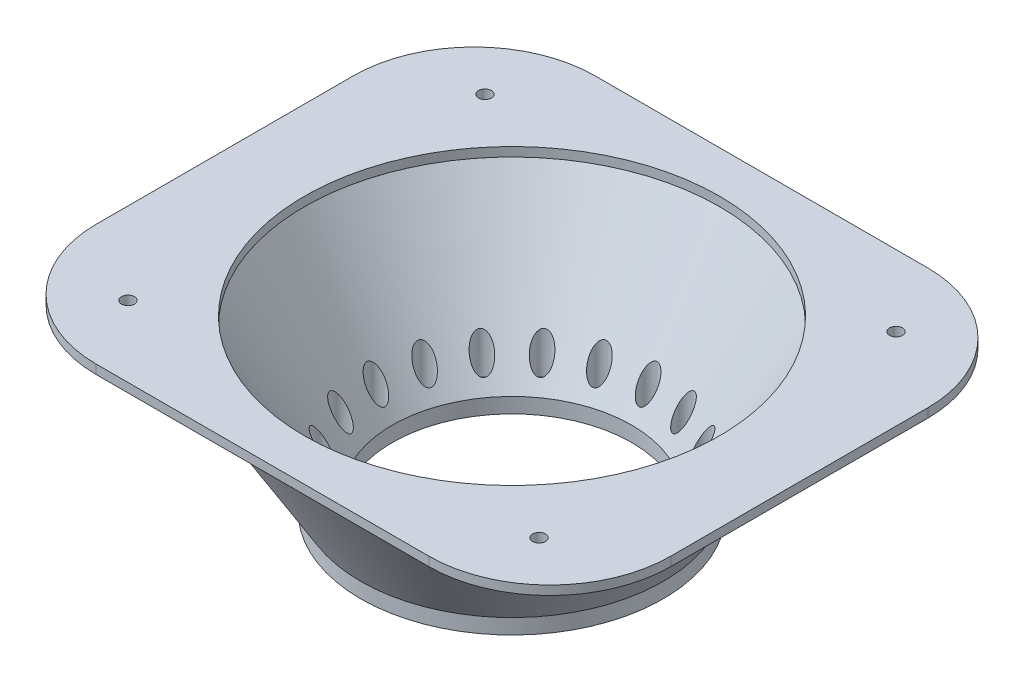
from build123d import *

# Parameters (mm, degrees)
SKETCH4_R           = 50
SKETCH4_R_2         = 39.565
SKETCH4_R_3         = 1.75
BOSS_EXTRUDE3_DEPTH = 5
SKETCH7_W           = 190
SKETCH7_H           = 165
SKETCH7_R           = 68.628897091
SKETCH7_R_2         = 2.15
BOSS_EXTRUDE4_DEPTH = 3
FILLET1_R           = 40
CUT_EXTRUDE1_START  = -5
SKETCH8_R           = 3
CUT_EXTRUDE1_DEPTH  = 133.721639549


with BuildPart() as part:
    # Sketch4 → Boss-Extrude3 (new body)
    with BuildSketch(Plane(origin=(0, 0, 0), x_dir=(1, 0, 0), z_dir=(0, 1, 0))):
        with Locations(Location((0, 0, 0), (0, 0, 270))):
            Circle(SKETCH4_R)
        with Locations(Location((0, 0, 0), (0, 0, 270))):
            Circle(SKETCH4_R_2, mode=Mode.SUBTRACT)
        with Locations(Location((0, -45, 0), (0, 0, 270))):
            Circle(SKETCH4_R_3, mode=Mode.SUBTRACT)
        with Locations(Location((-13.905764747, -42.797543233, 0), (0, 0, 270))):
            Circle(SKETCH4_R_3, mode=Mode.SUBTRACT)
        with Locations(Location((-26.450336353, -36.405764747, 0), (0, 0, 270))):
            Circle(SKETCH4_R_3, mode=Mode.SUBTRACT)
        with Locations(Location((-36.405764747, -26.450336353, 0), (0, 0, 270))):
            Circle(SKETCH4_R_3, mode=Mode.SUBTRACT)
        with Locations(Location((-42.797543233, -13.905764747, 0), (0, 0, 270))):
            Circle(SKETCH4_R_3, mode=Mode.SUBTRACT)
        with Locations(Location((-45, 0, 0), (0, 0, 270))):
            Circle(SKETCH4_R_3, mode=Mode.SUBTRACT)
        with Locations(Location((-42.797543233, 13.905764747, 0), (0, 0, 270))):
            Circle(SKETCH4_R_3, mode=Mode.SUBTRACT)
        with Locations(Location((-36.405764747, 26.450336353, 0), (0, 0, 270))):
            Circle(SKETCH4_R_3, mode=Mode.SUBTRACT)
        with Locations(Location((-26.450336353, 36.405764747, 0), (0, 0, 270))):
            Circle(SKETCH4_R_3, mode=Mode.SUBTRACT)
        with Locations(Location((-13.905764747, 42.797543233, 0), (0, 0, 270))):
            Circle(SKETCH4_R_3, mode=Mode.SUBTRACT)
        with Locations(Location((0, 45, 0), (0, 0, 270))):
            Circle(SKETCH4_R_3, mode=Mode.SUBTRACT)
        with Locations(Location((13.905764747, 42.797543233, 0), (0, 0, 270))):
            Circle(SKETCH4_R_3, mode=Mode.SUBTRACT)
        with Locations(Location((26.450336353, 36.405764747, 0), (0, 0, 270))):
            Circle(SKETCH4_R_3, mode=Mode.SUBTRACT)
        with Locations(Location((36.405764747, 26.450336353, 0), (0, 0, 270))):
            Circle(SKETCH4_R_3, mode=Mode.SUBTRACT)
        with Locations(Location((42.797543233, 13.905764747, 0), (0, 0, 270))):
            Circle(SKETCH4_R_3, mode=Mode.SUBTRACT)
        with Locations(Location((45, 0, 0), (0, 0, 270))):
            Circle(SKETCH4_R_3, mode=Mode.SUBTRACT)
        with Locations(Location((42.797543233, -13.905764747, 0), (0, 0, 270))):
            Circle(SKETCH4_R_3, mode=Mode.SUBTRACT)
        with Locations(Location((36.405764747, -26.450336353, 0), (0, 0, 270))):
            Circle(SKETCH4_R_3, mode=Mode.SUBTRACT)
        with Locations(Location((26.450336353, -36.405764747, 0), (0, 0, 270))):
            Circle(SKETCH4_R_3, mode=Mode.SUBTRACT)
        with Locations(Location((13.905764747, -42.797543233, 0), (0, 0, 270))):
            Circle(SKETCH4_R_3, mode=Mode.SUBTRACT)
    extrude(amount=BOSS_EXTRUDE3_DEPTH)

    # Sketch6 → Revolve1 (revolve)
    with BuildSketch(Plane(origin=(0, 0, 0), x_dir=(0, 0, -1), z_dir=(1, 0, 0)), mode=Mode.PRIVATE) as revolve1_sk:
        Polygon((-50, 5), (-79.06281292, 53), (-68.62781292, 53), (-39.565, 5), align=None)
    revolve(revolve1_sk.sketch.rotate(Axis((0, 0, 0), (0, 1, 0)), 180), axis=Axis((0, 0, 0), (0, 1, 0)))

    # Sketch7 → Boss-Extrude4 (add)
    with BuildSketch(Plane(origin=(0, 53, 0), x_dir=(1, 0, 0), z_dir=(0, 1, 0))):
        Rectangle(SKETCH7_W, SKETCH7_H)
        with Locations(Location((0, 0, 0), (0, 0, 270))):
            Circle(SKETCH7_R, mode=Mode.SUBTRACT)
        with Locations(Location((-67.952980655, 59.01179899, 0), (0, 0, 270))):
            Circle(SKETCH7_R_2, mode=Mode.SUBTRACT)
        with Locations(Location((67.952980655, 59.01179899, 0), (0, 0, 270))):
            Circle(SKETCH7_R_2, mode=Mode.SUBTRACT)
        with Locations(Location((67.952980655, -59.01179899, 0), (0, 0, 270))):
            Circle(SKETCH7_R_2, mode=Mode.SUBTRACT)
        with Locations(Location((-67.952980655, -59.01179899, 0), (0, 0, 270))):
            Circle(SKETCH7_R_2, mode=Mode.SUBTRACT)
    extrude(amount=BOSS_EXTRUDE4_DEPTH)

    # Fillet1
    fillet1_edges = [part.edges().sort_by_distance(p)[0] for p in [
        (-95, 54.5, -82.5),
        (-95, 54.5, 82.5),
        (95, 54.5, 82.5),
        (95, 54.5, -82.5),
    ]]
    fillet(fillet1_edges, radius=FILLET1_R)

    # Sketch8 → Cut-Extrude1 (cut, through all)
    with BuildSketch(Plane.XZ.offset(CUT_EXTRUDE1_START)):
        with Locations(Location((0, -45, 0), (0, 0, 270))):
            Circle(SKETCH8_R)
        with Locations(Location((-13.905764747, -42.797543233, 0), (0, 0, 270))):
            Circle(SKETCH8_R)
        with Locations(Location((-26.450336353, -36.405764747, 0), (0, 0, 270))):
            Circle(SKETCH8_R)
        with Locations(Location((-36.405764747, -26.450336353, 0), (0, 0, 270))):
            Circle(SKETCH8_R)
        with Locations(Location((-42.797543233, -13.905764747, 0), (0, 0, 270))):
            Circle(SKETCH8_R)
        with Locations(Location((-45, 0, 0), (0, 0, 270))):
            Circle(SKETCH8_R)
        with Locations(Location((-42.797543233, 13.905764747, 0), (0, 0, 270))):
            Circle(SKETCH8_R)
        with Locations(Location((-36.405764747, 26.450336353, 0), (0, 0, 270))):
            Circle(SKETCH8_R)
        with Locations(Location((-26.450336353, 36.405764747, 0), (0, 0, 270))):
            Circle(SKETCH8_R)
        with Locations(Location((-13.905764747, 42.797543233, 0), (0, 0, 270))):
            Circle(SKETCH8_R)
        with Locations(Location((0, 45, 0), (0, 0, 270))):
            Circle(SKETCH8_R)
        with Locations(Location((13.905764747, 42.797543233, 0), (0, 0, 270))):
            Circle(SKETCH8_R)
        with Locations(Location((26.450336353, 36.405764747, 0), (0, 0, 270))):
            Circle(SKETCH8_R)
        with Locations(Location((36.405764747, 26.450336353, 0), (0, 0, 270))):
            Circle(SKETCH8_R)
        with Locations(Location((42.797543233, 13.905764747, 0), (0, 0, 270))):
            Circle(SKETCH8_R)
        with Locations(Location((45, 0, 0), (0, 0, 270))):
            Circle(SKETCH8_R)
        with Locations(Location((42.797543233, -13.905764747, 0), (0, 0, 270))):
            Circle(SKETCH8_R)
        with Locations(Location((36.405764747, -26.450336353, 0), (0, 0, 270))):
            Circle(SKETCH8_R)
        with Locations(Location((26.450336353, -36.405764747, 0), (0, 0, 270))):
            Circle(SKETCH8_R)
        with Locations(Location((13.905764747, -42.797543233, 0), (0, 0, 270))):
            Circle(SKETCH8_R)
    extrude(amount=-CUT_EXTRUDE1_DEPTH, mode=Mode.SUBTRACT)


solid = part.part
